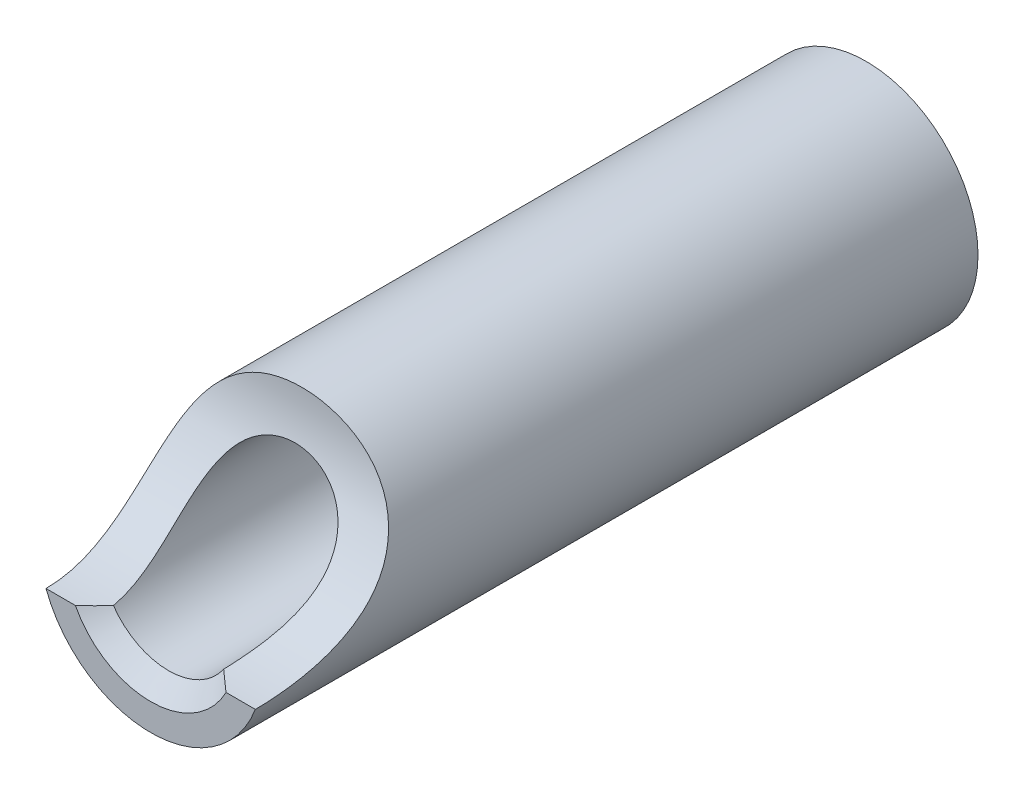
from build123d import *

# Parameters (mm, degrees)
SKETCH2_R               = 7.9375
SKETCH2_R_2             = 4.7625
BOSS_EXTRUDE1_DEPTH     = 50.8
CHAMFER1_SIZE           = 1.27
CUT_EXTRUDE1_DEPTH      = 53.025453506
CUT_EXTRUDE1_DEPTH_BACK = 53.025453506
SKETCH3_R               = 10.727398282


with BuildPart() as part:
    # Sketch2 → Boss-Extrude1 (new body)
    with BuildSketch(Plane.XY):
        Circle(SKETCH2_R)
        Circle(SKETCH2_R_2, mode=Mode.SUBTRACT)
    extrude(amount=BOSS_EXTRUDE1_DEPTH)

    # Chamfer1
    chamfer1_edges = [part.edges().sort_by_distance(p)[0] for p in [
        (-4.7625, 0, 0),
        (-4.7625, 0, 50.8),
    ]]
    chamfer(chamfer1_edges, length=CHAMFER1_SIZE)

    # Sketch3 → Cut-Extrude1 (cut, two sides: drawn at the far end of the back side and taken through both)
    with BuildSketch(Plane(origin=(0, 0, 0), x_dir=(0, 0, -1), z_dir=(1, 0, 0)).offset(-CUT_EXTRUDE1_DEPTH_BACK)):
        with Locations((-50.8, 7.9375)):
            Circle(SKETCH3_R)
    extrude(amount=CUT_EXTRUDE1_DEPTH + CUT_EXTRUDE1_DEPTH_BACK, mode=Mode.SUBTRACT)


solid = part.part
